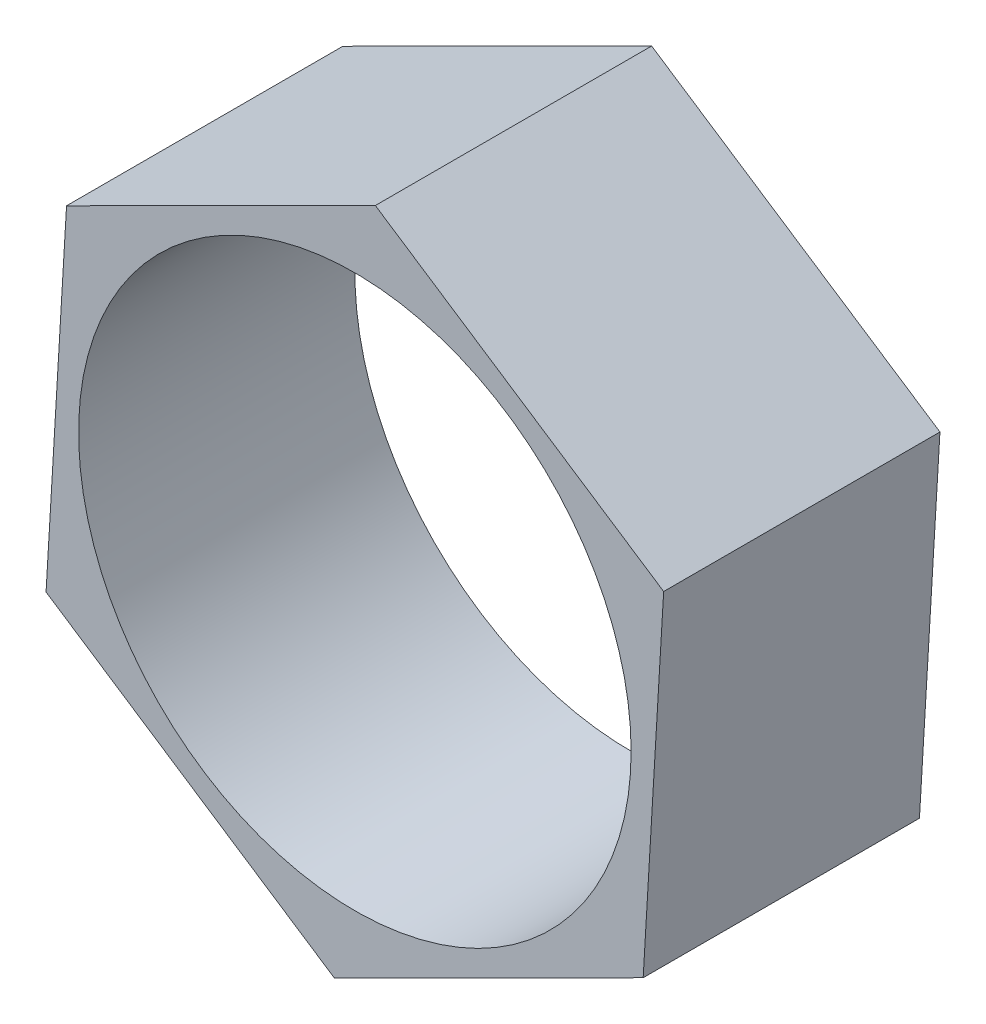
from build123d import *

# Parameters (mm, degrees)
SKETCH1_R           = 1
BOSS_EXTRUDE1_DEPTH = 1


with BuildPart() as part:
    # Sketch1 → Boss-Extrude1 (new body)
    with BuildSketch(Plane.XY):
        Polygon((0.074171321, 1.247797506), (-1.043538678, 0.688133001), (-1.117709999, -0.559664505), (-0.074171321, -1.247797506), (1.043538678, -0.688133001), (1.117709999, 0.559664505), align=None)
        Circle(SKETCH1_R, mode=Mode.SUBTRACT)
    extrude(amount=BOSS_EXTRUDE1_DEPTH)


solid = part.part
